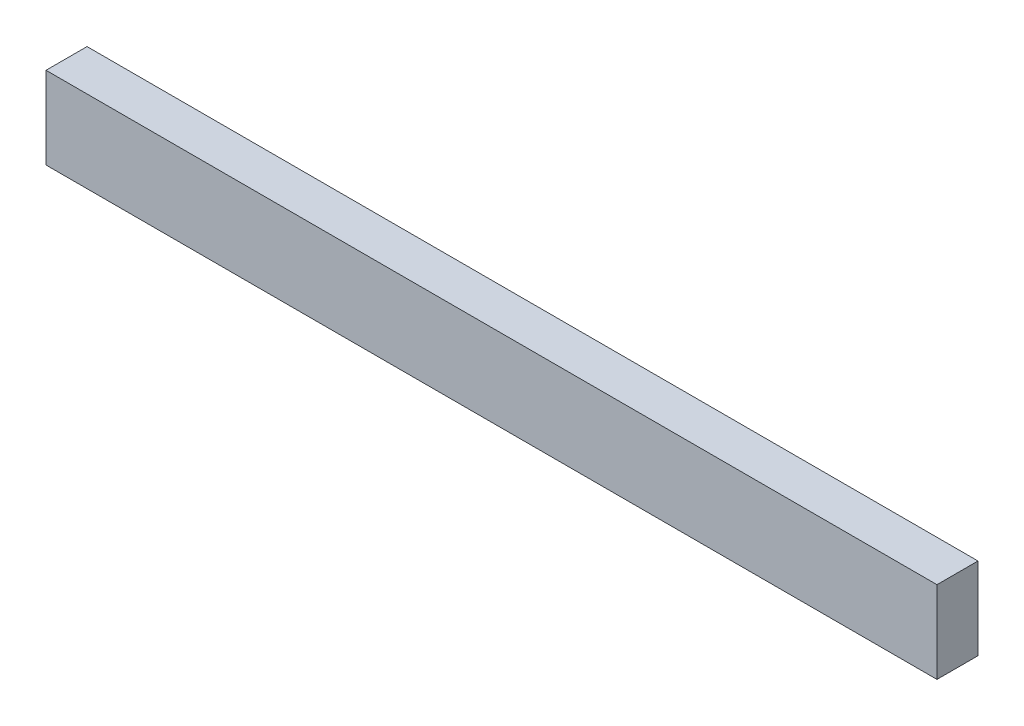
from build123d import *

# Parameters (mm, degrees)
SKETCH1_W           = 120.65
SKETCH1_H           = 11.1125
BOSS_EXTRUDE1_DEPTH = 5.55625


with BuildPart() as part:
    # Sketch1 → Boss-Extrude1 (new body)
    with BuildSketch(Plane.XY):
        with Locations((-60.325, 5.55625)):
            Rectangle(SKETCH1_W, SKETCH1_H)
    extrude(amount=BOSS_EXTRUDE1_DEPTH)


solid = part.part
